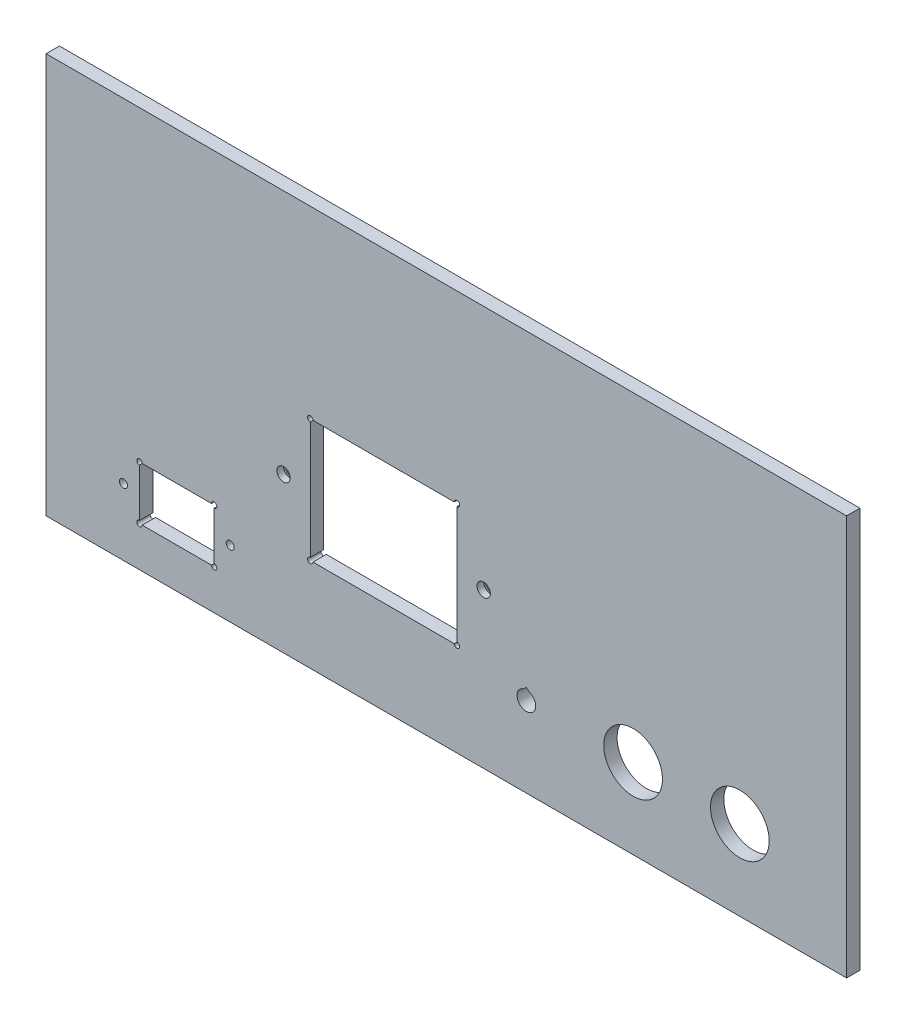
from build123d import *

# Parameters (mm, degrees)
SKIZZE1_W                       = 300
SKIZZE1_H                       = 150
AUFSATZ_LINEAR_AUSTRAGEN1_DEPTH = 5
SKIZZE2_R                       = 1.5
SKIZZE2_W                       = 28
SKIZZE2_H                       = 20
SCHNITT_LINEAR_AUSTRAGEN1_DEPTH = 168.779617356
SKIZZE3_R                       = 11
SCHNITT_LINEAR_AUSTRAGEN2_DEPTH = 168.779617356
SKIZZE4_R                       = 1
SCHNITT_LINEAR_AUSTRAGEN3_DEPTH = 168.779617356
SKIZZE5_R                       = 2.5
SKIZZE5_W                       = 55
SKIZZE5_H                       = 46
SCHNITT_LINEAR_AUSTRAGEN4_DEPTH = 168.779617356
SKIZZE6_R                       = 1
SCHNITT_LINEAR_AUSTRAGEN5_DEPTH = 168.779617356
SCHNITT_LINEAR_AUSTRAGEN6_DEPTH = 168.779617356
FASE1_SIZE                      = 2.5


with BuildPart() as part:
    # Skizze1 → Aufsatz-Linear austragen1 (new body)
    with BuildSketch(Plane.XY):
        Rectangle(SKIZZE1_W, SKIZZE1_H)
    extrude(amount=AUFSATZ_LINEAR_AUSTRAGEN1_DEPTH)

    # Skizze2 → Schnitt-Linear austragen1 (cut, through all)
    with BuildSketch(Plane.XY.offset(5)):
        with Locations((-121, -50)):
            Circle(SKIZZE2_R)
        with Locations((-81, -50)):
            Circle(SKIZZE2_R)
        with Locations((-101, -50)):
            Rectangle(SKIZZE2_W, SKIZZE2_H)
    extrude(amount=-SCHNITT_LINEAR_AUSTRAGEN1_DEPTH, mode=Mode.SUBTRACT)

    # Skizze3 → Schnitt-Linear austragen2 (cut, through all)
    with BuildSketch(Plane.XY.offset(5)):
        with Locations((110, -45)):
            Circle(SKIZZE3_R)
        with Locations((70, -45)):
            Circle(SKIZZE3_R)
    extrude(amount=-SCHNITT_LINEAR_AUSTRAGEN2_DEPTH, mode=Mode.SUBTRACT)

    # Skizze4 → Schnitt-Linear austragen3 (cut, through all)
    with BuildSketch(Plane.XY.offset(5)):
        with Locations((-115, -40)):
            Circle(SKIZZE4_R)
        with Locations((-87, -40)):
            Circle(SKIZZE4_R)
        with Locations((-87, -60)):
            Circle(SKIZZE4_R)
        with Locations((-115, -60)):
            Circle(SKIZZE4_R)
    extrude(amount=-SCHNITT_LINEAR_AUSTRAGEN3_DEPTH, mode=Mode.SUBTRACT)

    # Skizze5 → Schnitt-Linear austragen4 (cut, through all)
    with BuildSketch(Plane.XY.offset(5)):
        with Locations((-61, -17)):
            Circle(SKIZZE5_R)
        with Locations((14, -17)):
            Circle(SKIZZE5_R)
        with Locations((-23.5, -17)):
            Rectangle(SKIZZE5_W, SKIZZE5_H)
    extrude(amount=-SCHNITT_LINEAR_AUSTRAGEN4_DEPTH, mode=Mode.SUBTRACT)

    # Skizze6 → Schnitt-Linear austragen5 (cut, through all)
    with BuildSketch(Plane.XY.offset(5)):
        with Locations((-51, 6)):
            Circle(SKIZZE6_R)
        with Locations((4, 6)):
            Circle(SKIZZE6_R)
        with Locations((4, -40)):
            Circle(SKIZZE6_R)
        with Locations((-51, -40)):
            Circle(SKIZZE6_R)
    extrude(amount=-SCHNITT_LINEAR_AUSTRAGEN5_DEPTH, mode=Mode.SUBTRACT)

    # Skizze7 → Schnitt-Linear austragen6 (cut, through all)
    with BuildSketch(Plane.XY.offset(5)):
        with BuildLine():
            Line((30, -40.645898034), (29, -41.645898034))
            ThreePointArc((29, -41.645898034), (30, -48.5), (31, -41.645898034))
            Line((31, -41.645898034), (30, -40.645898034))
        make_face()
    extrude(amount=-SCHNITT_LINEAR_AUSTRAGEN6_DEPTH, mode=Mode.SUBTRACT)

    # Fase1
    fase1_edges = [part.edges().sort_by_distance(p)[0] for p in [
        (-63.5, -17, 0),
        (11.5, -17, 0),
    ]]
    chamfer(fase1_edges, length=FASE1_SIZE)


solid = part.part
